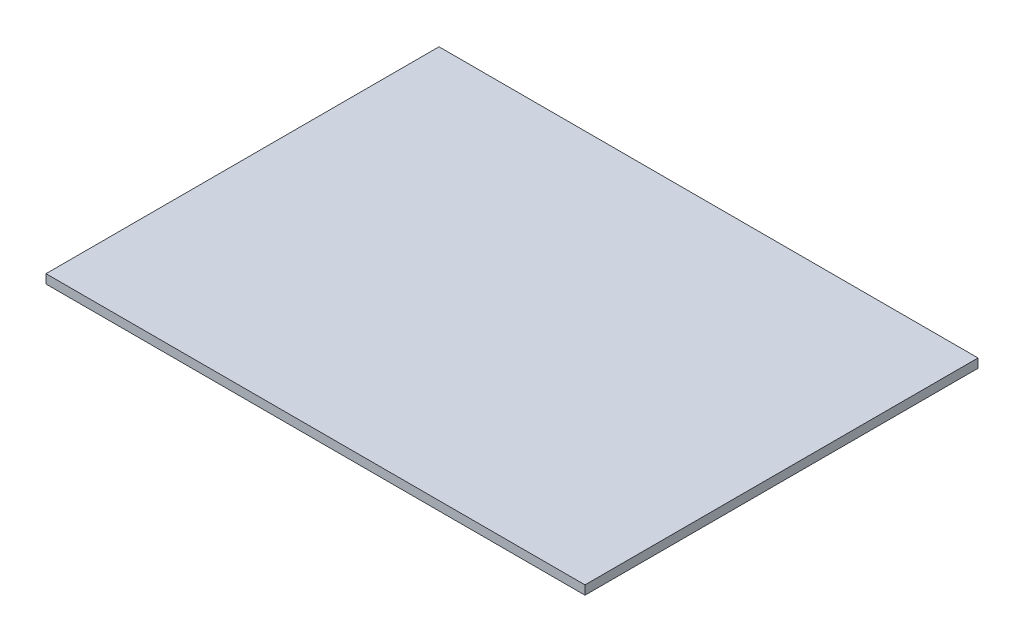
from build123d import *

# Parameters (mm, degrees)
SKETCH_1_W        = 96
SKETCH_1_H        = 70
EXTRUDE_333_DEPTH = 0.8


with BuildPart() as part:
    # ｽｹｯﾁ1 → Extrude 333 (new, symmetric)
    with BuildSketch(Plane(origin=(0, 0, 0), x_dir=(1, 0, 0), z_dir=(0, 1, 0))):
        with Locations((48, 0)):
            Rectangle(SKETCH_1_W, SKETCH_1_H)
    extrude(amount=EXTRUDE_333_DEPTH, both=True)


solid = part.part
